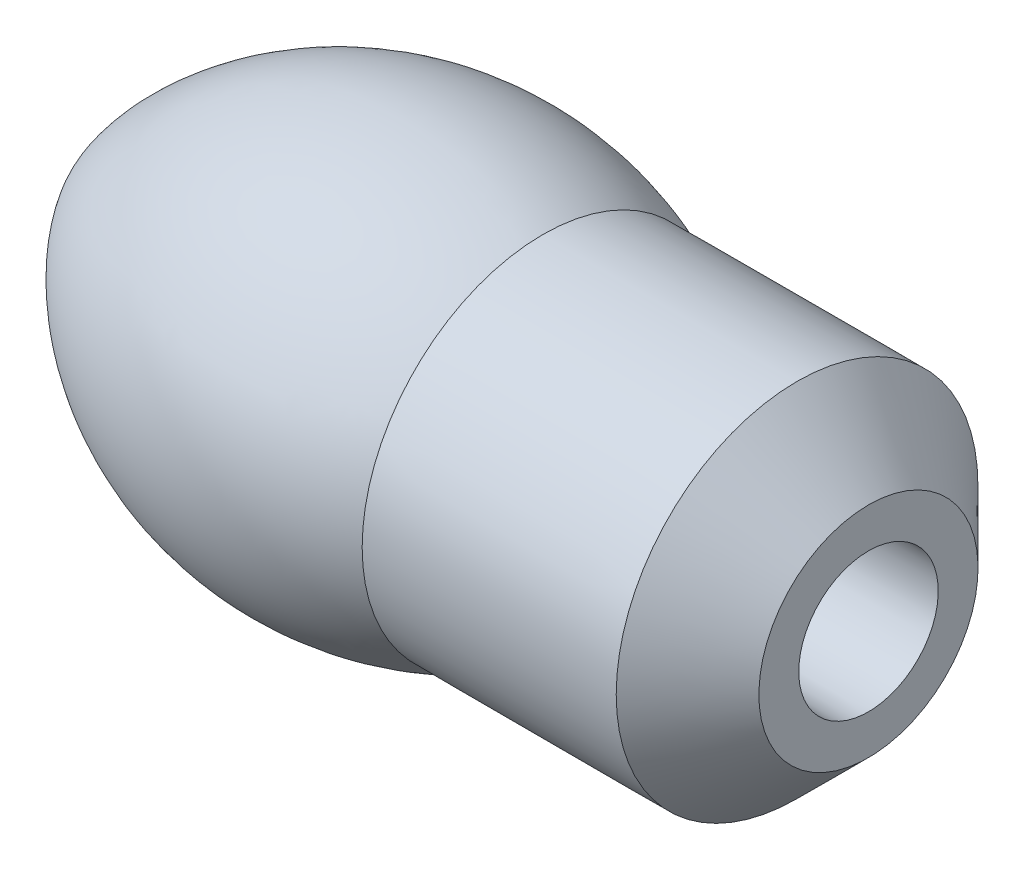
from build123d import *


with BuildPart() as part:
    # Sketch1 → Revolve1 (revolve)
    with BuildSketch(Plane.XY):
        with BuildLine():
            Line((0, 26.220545713), (60, 26.220545713))
            Line((60, 26.220545713), (60, 41.220545713))
            Line((60, 41.220545713), (33.129942315, 68.090603398))
            Line((33.129942315, 68.090603398), (-62.646462349, 68.090603398))
            ThreePointArc((-62.646462349, 68.090603398), (-163.893113975, 70.270980333), (-237.027067228, 0.220545713))
            Line((-237.027067228, 0.220545713), (0, 0))
            Line((0, 0), (0, 26.220545713))
        make_face()
    revolve(axis=Axis((0, 0, 0), (-0.9999995671164572, 0.0009304659576057396, 0)))


solid = part.part
